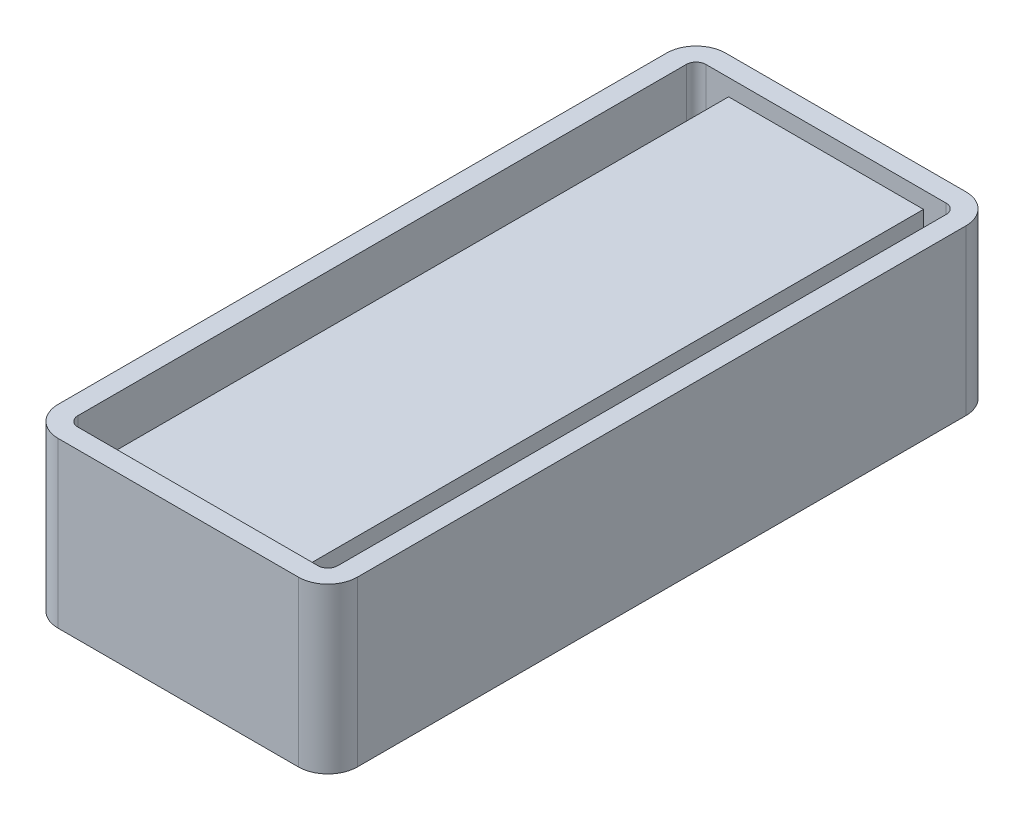
from build123d import *

# Parameters (mm, degrees)
BOSS_EXTRUDE1_DEPTH = 15
BOSS_EXTRUDE2_DEPTH = 1.7


with BuildPart() as part:
    # Sketch1 → Boss-Extrude1 (new body)
    with BuildSketch(Plane(origin=(0, 0, 0), x_dir=(1, 0, 0), z_dir=(0, 1, 0))):
        with BuildLine():
            ThreePointArc((-12.2, 33.9), (-14.321320344, 33.021320344), (-15.2, 30.9))
            Line((-15.2, 30.9), (-15.2, -30.9))
            ThreePointArc((-15.2, -30.9), (-14.321320344, -33.021320344), (-12.2, -33.9))
            Line((-12.2, -33.9), (12.2, -33.9))
            ThreePointArc((12.2, -33.9), (14.321320344, -33.021320344), (15.2, -30.9))
            Line((15.2, -30.9), (15.2, 30.9))
            ThreePointArc((15.2, 30.9), (14.321320344, 33.021320344), (12.2, 33.9))
            Line((12.2, 33.9), (-12.2, 33.9))
        make_face()
        with BuildLine():
            Line((-12.2, 31.9), (-9.9, 31.9))
            Line((-9.9, 31.9), (-9.9, -31.9))
            Line((-9.9, -31.9), (-12.2, -31.9))
            ThreePointArc((-12.2, -31.9), (-12.907106781, -31.607106781), (-13.2, -30.9))
            Line((-13.2, -30.9), (-13.2, 30.9))
            ThreePointArc((-13.2, 30.9), (-12.907106781, 31.607106781), (-12.2, 31.9))
        make_face(mode=Mode.SUBTRACT)
        with BuildLine():
            Line((12.2, -31.9), (9.9, -31.9))
            Line((9.9, -31.9), (9.9, 31.9))
            Line((9.9, 31.9), (12.2, 31.9))
            ThreePointArc((12.2, 31.9), (12.907106781, 31.607106781), (13.2, 30.9))
            Line((13.2, 30.9), (13.2, -30.9))
            ThreePointArc((13.2, -30.9), (12.907106781, -31.607106781), (12.2, -31.9))
        make_face(mode=Mode.SUBTRACT)
    extrude(amount=BOSS_EXTRUDE1_DEPTH)

    # Sketch2 → Boss-Extrude2 (add)
    with BuildSketch(Plane(origin=(0, 15, 0), x_dir=(1, 0, 0), z_dir=(0, 1, 0))):
        with BuildLine():
            Line((12.2, 33.9), (-12.2, 33.9))
            ThreePointArc((-12.2, 33.9), (-14.321320344, 33.021320344), (-15.2, 30.9))
            Line((-15.2, 30.9), (-15.2, -30.9))
            ThreePointArc((-15.2, -30.9), (-14.321320344, -33.021320344), (-12.2, -33.9))
            Line((-12.2, -33.9), (12.2, -33.9))
            ThreePointArc((12.2, -33.9), (14.321320344, -33.021320344), (15.2, -30.9))
            Line((15.2, -30.9), (15.2, 30.9))
            ThreePointArc((15.2, 30.9), (14.321320344, 33.021320344), (12.2, 33.9))
        make_face()
        with BuildLine():
            Line((12.2, 31.9), (-12.2, 31.9))
            ThreePointArc((-12.2, 31.9), (-12.907106781, 31.607106781), (-13.2, 30.9))
            Line((-13.2, 30.9), (-13.2, -30.9))
            ThreePointArc((-13.2, -30.9), (-12.907106781, -31.607106781), (-12.2, -31.9))
            Line((-12.2, -31.9), (12.2, -31.9))
            ThreePointArc((12.2, -31.9), (12.907106781, -31.607106781), (13.2, -30.9))
            Line((13.2, -30.9), (13.2, 30.9))
            ThreePointArc((13.2, 30.9), (12.907106781, 31.607106781), (12.2, 31.9))
        make_face(mode=Mode.SUBTRACT)
    extrude(amount=BOSS_EXTRUDE2_DEPTH)


solid = part.part
